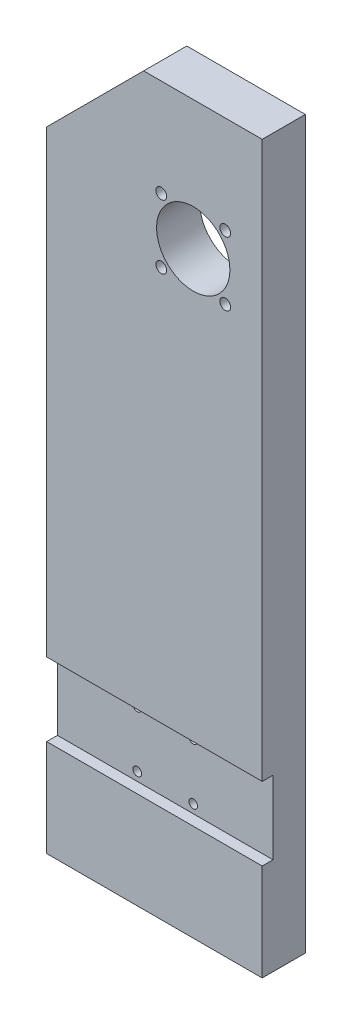
from build123d import *

# Parameters (mm, degrees)
SKETCH1_W             = 100
SKETCH1_H             = 337
SKETCH1_R             = 17
SKETCH1_R_2           = 2.5
SKETCH1_R_3           = 2
BOSS_EXTRUDE1_DEPTH   = 20
CHAMFER1_SIZE         = 45
SKETCH2_W             = 100
SKETCH2_H             = 34
CUT_EXTRUDE1_DEPTH    = 5
M4_TAPPED_HOLE1_D     = 3.3
M4_TAPPED_HOLE1_DEPTH = 16.1
M4_TAPPED_HOLE1_TIP   = 0.991420021


with BuildPart() as part:
    # Sketch1 → Boss-Extrude1 (new body)
    with BuildSketch(Plane.XY):
        with Locations((47.704546062, 452.000370419)):
            Rectangle(SKETCH1_W, SKETCH1_H)
        with Locations((65.704546062, 560.500370419)):
            Circle(SKETCH1_R, mode=Mode.SUBTRACT)
        with Locations((80.553788467, 575.349612824)):
            Circle(SKETCH1_R_2, mode=Mode.SUBTRACT)
        with Locations((80.553788467, 545.651128014)):
            Circle(SKETCH1_R_2, mode=Mode.SUBTRACT)
        with Locations((50.855303657, 545.651128014)):
            Circle(SKETCH1_R_2, mode=Mode.SUBTRACT)
        with Locations((50.855303657, 575.349612824)):
            Circle(SKETCH1_R_2, mode=Mode.SUBTRACT)
        with Locations((34.704546062, 358.500370419)):
            Circle(SKETCH1_R_3, mode=Mode.SUBTRACT)
        with Locations(Location((60.704546062, 358.500370419, 0), (0, 0, 180))):
            Circle(SKETCH1_R_3, mode=Mode.SUBTRACT)
        with Locations((60.704546062, 332.500370419)):
            Circle(SKETCH1_R_3, mode=Mode.SUBTRACT)
        with Locations(Location((34.704546062, 332.500370419, 0), (0, 0, 180))):
            Circle(SKETCH1_R_3, mode=Mode.SUBTRACT)
    extrude(amount=BOSS_EXTRUDE1_DEPTH)

    # Chamfer1
    chamfer1_edges = [part.edges().sort_by_distance(p)[0] for p in [
        (-2.295453938, 620.500370419, 10),
    ]]
    chamfer(chamfer1_edges, length=CHAMFER1_SIZE)

    # Sketch2 → Cut-Extrude1 (cut)
    with BuildSketch(Plane.XY.offset(20)):
        with Locations((47.704546062, 345.500370419)):
            Rectangle(SKETCH2_W, SKETCH2_H)
    extrude(amount=-CUT_EXTRUDE1_DEPTH, mode=Mode.SUBTRACT)

    # M4 Tapped Hole1
    with Locations(Plane(origin=(7.704546062, 283.500370419, 10), x_dir=(0, 0, -1), z_dir=(0, -1, 0))):
        with Locations((0, 0), (0, 20), (0, 60), (0, 80)):
            Hole(M4_TAPPED_HOLE1_D / 2, depth=M4_TAPPED_HOLE1_DEPTH)
            with Locations((0, 0, -(M4_TAPPED_HOLE1_DEPTH + M4_TAPPED_HOLE1_TIP / 2))):  # 118° drill point
                Cone(0, M4_TAPPED_HOLE1_D / 2, M4_TAPPED_HOLE1_TIP, mode=Mode.SUBTRACT)


solid = part.part
